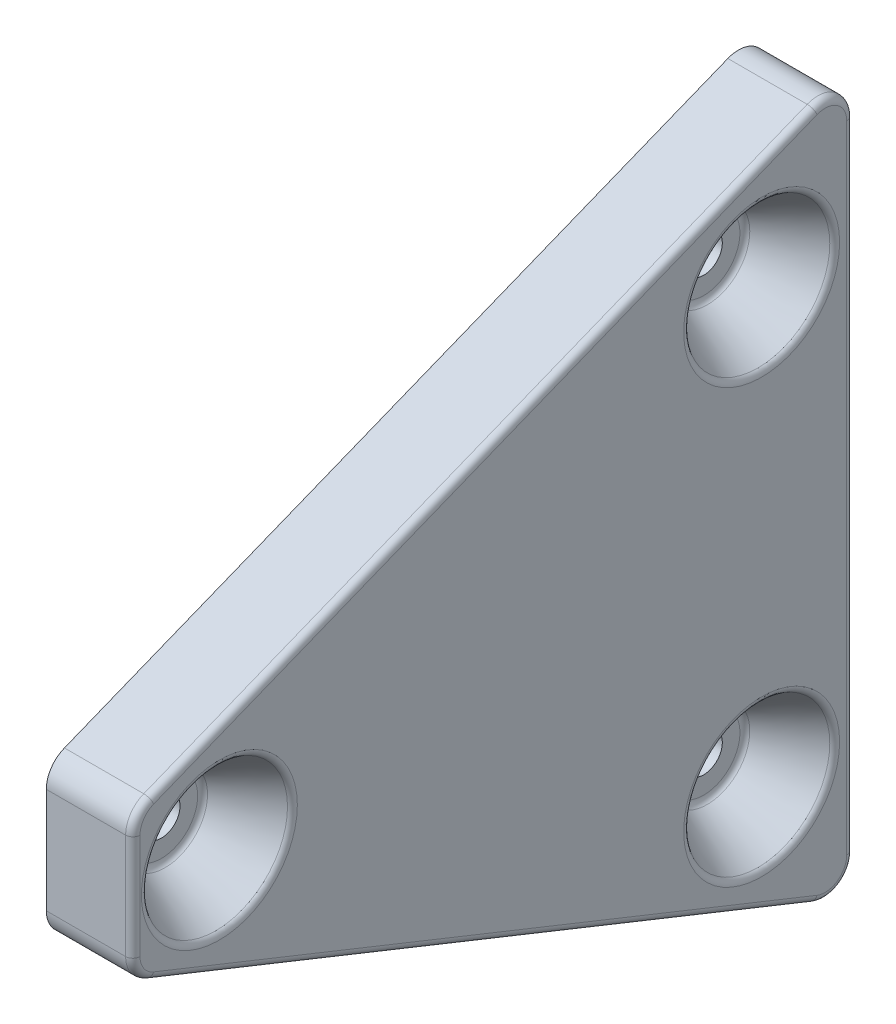
from build123d import *

# Parameters (mm, degrees)
BOSS_EXTRUDE1_DEPTH          = 7.62
SKETCH2_R                    = 1.6383
CUT_EXTRUDE1_DEPTH           = 74.262617229
CUT_EXTRUDE2_START           = -5.1
SKETCH3_R                    = 3.556
CUT_EXTRUDE2_DEPTH           = 79.362617229
CUT_EXTRUDE2_DRAFT           = -30
CUT_EXTRUDE2_PROFILE_2_DEPTH = 79.362617229
CUT_EXTRUDE2_PROFILE_2_DRAFT = -30
CUT_EXTRUDE2_PROFILE_3_DEPTH = 79.362617229
CUT_EXTRUDE2_PROFILE_3_DRAFT = -30
FILLET1_R                    = 2.54
FILLET2_R                    = 0.635


with BuildPart() as part:
    # Sketch1 → Boss-Extrude1 (new body)
    with BuildSketch(Plane(origin=(0, 0, 0), x_dir=(0, 0, -1), z_dir=(1, 0, 0))):
        Polygon((0, 10.336489519), (0, -2.363510481), (63.5, -27.763510481), (63.5, 35.736489519), align=None)
    extrude(amount=BOSS_EXTRUDE1_DEPTH)

    # Sketch2 → Cut-Extrude1 (cut, through all)
    with BuildSketch(Plane(origin=(7.62, 0, 0), x_dir=(0, 0, -1), z_dir=(1, 0, 0))):
        with Locations((55.372, 23.036489519)):
            Circle(SKETCH2_R)
        with Locations((7.62, 3.986489519)):
            Circle(SKETCH2_R)
        with Locations((55.372, -15.063510481)):
            Circle(SKETCH2_R)
    extrude(amount=-CUT_EXTRUDE1_DEPTH, mode=Mode.SUBTRACT)


with BuildPart() as cut_extrude2_tool:
    # Sketch3 → Cut-Extrude2 (with draft: the straight prism first)
    with BuildSketch(Plane(origin=(7.62, 0, 0), x_dir=(0, 0, -1), z_dir=(1, 0, 0)).offset(CUT_EXTRUDE2_START)):
        with Locations((7.62, 3.986489519)):
            Circle(SKETCH3_R)
    extrude(amount=CUT_EXTRUDE2_DEPTH)
    # Cut-Extrude2: the draft: its side faces are tilted about the plane it starts from
    cut_extrude2_sides = [cut_extrude2_tool.faces().sort_by_distance(p)[0] for p in [
        (42.201308614, 3.986489519, -4.064),
    ]]
    draft(cut_extrude2_sides, Plane(origin=(7.62, 0, 0), x_dir=(0, 0, -1), z_dir=(1, 0, 0)).offset(CUT_EXTRUDE2_START), CUT_EXTRUDE2_DRAFT)


with BuildPart() as part_1:
    add(part.part)

    # Cut-Extrude2: cut by cut_extrude2_tool
    add(cut_extrude2_tool.part, mode=Mode.SUBTRACT)


with BuildPart() as cut_extrude2_profile_2_tool:
    # Sketch3 → Cut-Extrude2 profile 2 (with draft: the straight prism first)
    with BuildSketch(Plane(origin=(7.62, 0, 0), x_dir=(0, 0, -1), z_dir=(1, 0, 0)).offset(CUT_EXTRUDE2_START)):
        with Locations((55.372, 23.036489519)):
            Circle(SKETCH3_R)
    extrude(amount=CUT_EXTRUDE2_PROFILE_2_DEPTH)
    # Cut-Extrude2 profile 2: the draft: its side faces are tilted about the plane it starts from
    cut_extrude2_profile_2_sides = [cut_extrude2_profile_2_tool.faces().sort_by_distance(p)[0] for p in [
        (42.201308614, 23.036489519, -51.816),
    ]]
    draft(cut_extrude2_profile_2_sides, Plane(origin=(7.62, 0, 0), x_dir=(0, 0, -1), z_dir=(1, 0, 0)).offset(CUT_EXTRUDE2_START), CUT_EXTRUDE2_PROFILE_2_DRAFT)


with BuildPart() as part_2:
    add(part_1.part)

    # Cut-Extrude2 profile 2: cut by cut_extrude2_profile_2_tool
    add(cut_extrude2_profile_2_tool.part, mode=Mode.SUBTRACT)


with BuildPart() as cut_extrude2_profile_3_tool:
    # Sketch3 → Cut-Extrude2 profile 3 (with draft: the straight prism first)
    with BuildSketch(Plane(origin=(7.62, 0, 0), x_dir=(0, 0, -1), z_dir=(1, 0, 0)).offset(CUT_EXTRUDE2_START)):
        with Locations((55.372, -15.063510481)):
            Circle(SKETCH3_R)
    extrude(amount=CUT_EXTRUDE2_PROFILE_3_DEPTH)
    # Cut-Extrude2 profile 3: the draft: its side faces are tilted about the plane it starts from
    cut_extrude2_profile_3_sides = [cut_extrude2_profile_3_tool.faces().sort_by_distance(p)[0] for p in [
        (42.201308614, -15.063510481, -51.816),
    ]]
    draft(cut_extrude2_profile_3_sides, Plane(origin=(7.62, 0, 0), x_dir=(0, 0, -1), z_dir=(1, 0, 0)).offset(CUT_EXTRUDE2_START), CUT_EXTRUDE2_PROFILE_3_DRAFT)


with BuildPart() as part_3:
    add(part_2.part)

    # Cut-Extrude2 profile 3: cut by cut_extrude2_profile_3_tool
    add(cut_extrude2_profile_3_tool.part, mode=Mode.SUBTRACT)

    # Fillet1
    fillet1_edges = [part_3.edges().sort_by_distance(p)[0] for p in [
        (3.81, 35.736489519, -63.5),
        (3.81, -27.763510481, -63.5),
        (3.81, -2.363510481, 0),
        (3.81, 10.336489519, 0),
    ]]
    fillet(fillet1_edges, radius=FILLET1_R)

    # Fillet2
    fillet2_edges = [part_3.edges().sort_by_distance(p)[0] for p in [
        (7.62, 3.986489519, -1.119513627),
        (2.52, 3.986489519, -4.064),
        (7.62, 23.036489519, -48.871513627),
        (2.52, 23.036489519, -51.816),
        (7.62, -15.063510481, -48.871513627),
        (2.52, -15.063510481, -51.816),
        (7.62, 3.986489519, -63.5),
        (7.62, -14.686177553, -30.806667682),
        (7.62, 22.659156592, -30.806667682),
        (7.62, 3.986489519, 0),
        (7.62, 10.040822973, -0.436709235),
        (7.62, -2.067843934, -0.436709235),
        (7.62, 34.088116563, -62.383997176),
        (7.62, -26.115137524, -62.383997176),
    ]]
    fillet(fillet2_edges, radius=FILLET2_R)


solid = part_3.part
